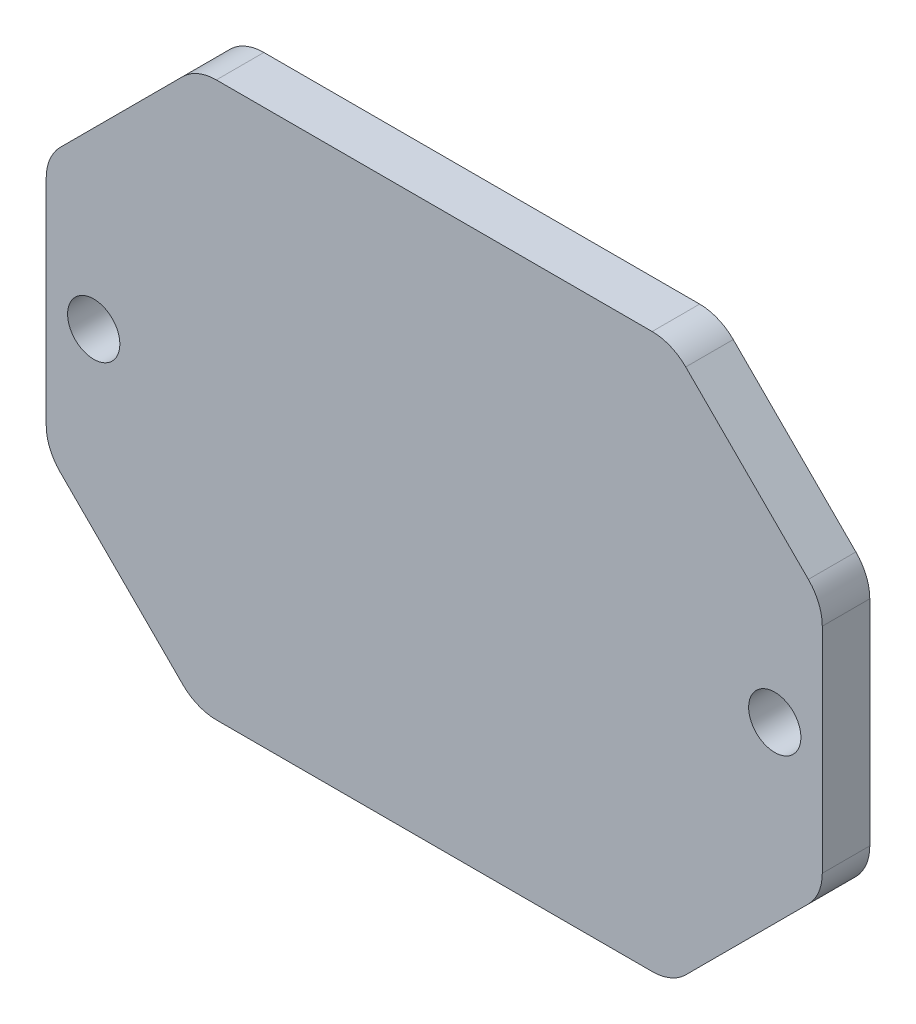
from build123d import *

# Parameters (mm, degrees)
SKETCH_1_W          = 49
SKETCH_1_H          = 34.996183206
EXTRUDE_1_DEPTH     = 3
CHAMFER_1_SIZE      = 9.5
FILLET_1_R          = 3
SKETCH_2_R          = 1.65
CUT_EXTRUDE_1_DEPTH = 31.256126813


with BuildPart() as part:
    # 草图1 → 凸台-拉伸1 (new body)
    with BuildSketch(Plane.XY):
        Rectangle(SKETCH_1_W, SKETCH_1_H)
    extrude(amount=EXTRUDE_1_DEPTH)

    # 倒角1
    chamfer_1_edges = [part.edges().sort_by_distance(p)[0] for p in [
        (24.5, -17.498091603, 1.5),
        (-24.5, -17.498091603, 1.5),
        (-24.5, 17.498091603, 1.5),
        (24.5, 17.498091603, 1.5),
    ]]
    chamfer(chamfer_1_edges, length=CHAMFER_1_SIZE)

    # 圆角1
    fillet_1_edges = [part.edges().sort_by_distance(p)[0] for p in [
        (-24.5, -7.998091603, 1.5),
        (-24.5, 7.998091603, 1.5),
        (15, 17.498091603, 1.5),
        (-15, 17.498091603, 1.5),
        (15, -17.498091603, 1.5),
        (-15, -17.498091603, 1.5),
        (24.5, 7.998091603, 1.5),
        (24.5, -7.998091603, 1.5),
    ]]
    fillet(fillet_1_edges, radius=FILLET_1_R)

    # 草图2 → 切除-拉伸1 (cut, through all)
    with BuildSketch(Plane.XY.offset(3)):
        with Locations((-21.5, 0)):
            Circle(SKETCH_2_R)
        with Locations((21.5, 0)):
            Circle(SKETCH_2_R)
    extrude(amount=-CUT_EXTRUDE_1_DEPTH, mode=Mode.SUBTRACT)


solid = part.part
